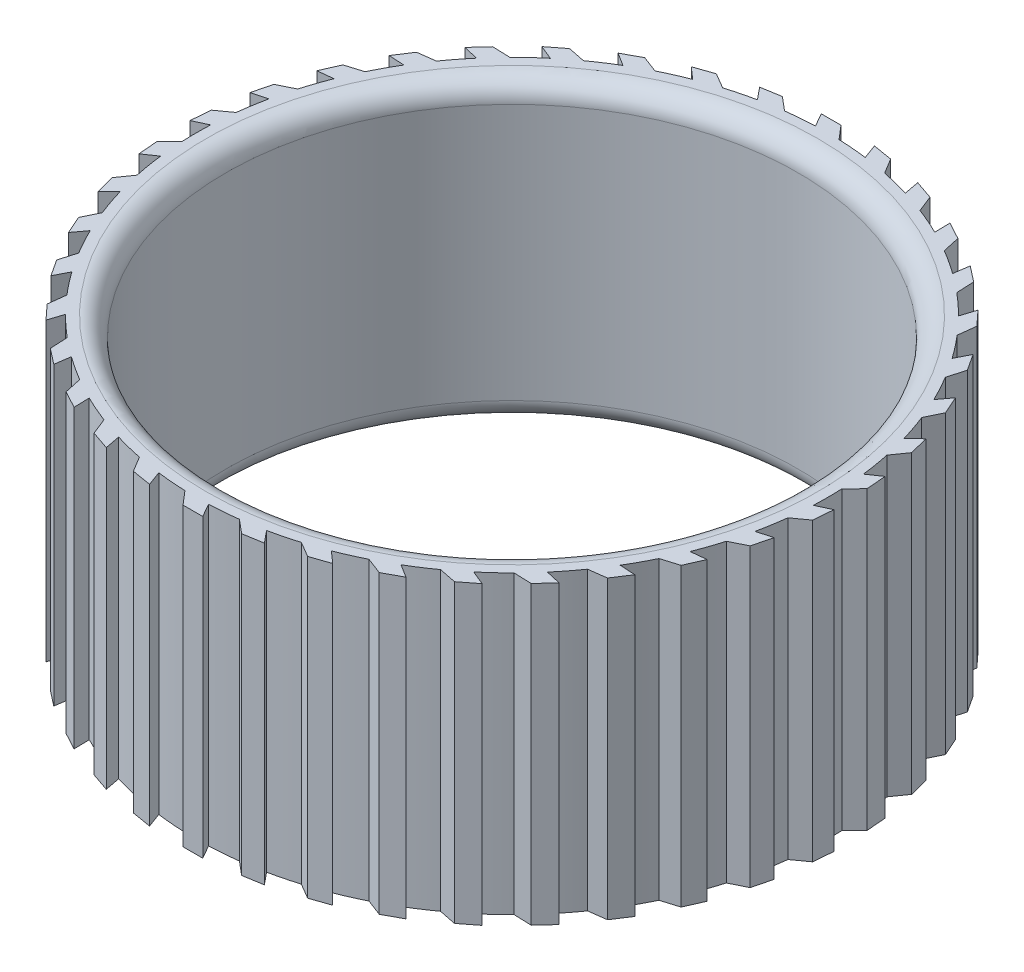
from build123d import *

# Parameters (mm, degrees)
SKETCH1_R           = 32
SKETCH1_R_2         = 29
BOSS_EXTRUDE1_DEPTH = 15
BOSS_EXTRUDE2_START = -30
BOSS_EXTRUDE2_DEPTH = 30
FILLET1_R           = 2


with BuildPart() as part:
    # Sketch1 → Boss-Extrude1 (new, symmetric)
    with BuildSketch(Plane(origin=(0, 0, 0), x_dir=(1, 0, 0), z_dir=(0, 1, 0))):
        with Locations(Location((0, 0, 0), (0, 0, 270))):
            Circle(SKETCH1_R)
        with Locations(Location((0, 0, 0), (0, 0, 270))):
            Circle(SKETCH1_R_2, mode=Mode.SUBTRACT)
    extrude(amount=BOSS_EXTRUDE1_DEPTH, both=True)

    # Sketch2 → Boss-Extrude2 (add)
    with BuildSketch(Plane.XZ.offset(15).offset(BOSS_EXTRUDE2_START)):
        with BuildLine():
            Line((0, 33.345654869), (2, 33.345654869))
            Line((2, 33.345654869), (1.217357341, 31.976836008))
            ThreePointArc((1.217357341, 31.976836008), (0.022430691, 31.999992139), (-1.172527247, 31.97851122))
            Line((-1.172527247, 31.97851122), (0, 33.345654869))
        make_face()
        with BuildLine():
            Line((5.488514401, 32.890863599), (4.106954448, 31.73535765))
            ThreePointArc((4.106954448, 31.73535765), (5.289150361, 31.559861984), (6.463968395, 31.340343211))
            Line((6.463968395, 31.340343211), (7.461237008, 32.561674419))
            Line((7.461237008, 32.561674419), (5.488514401, 32.890863599))
        make_face()
        with BuildLine():
            Line((10.827316436, 31.538895311), (9.274409132, 30.626546251))
            ThreePointArc((9.274409132, 30.626546251), (10.411595797, 30.258861065), (11.534259241, 29.848967549))
            Line((11.534259241, 29.848967549), (12.71895092, 30.889496372))
            Line((12.71895092, 30.889496372), (10.827316436, 31.538895311))
        make_face()
        with BuildLine():
            Line((15.870777504, 29.326628174), (14.188882112, 28.682322507))
            ThreePointArc((14.188882112, 28.682322507), (15.25004004, 28.132477296), (16.289925563, 27.543389863))
            Line((16.289925563, 27.543389863), (17.629725006, 28.374733388))
            Line((17.629725006, 28.374733388), (15.870777504, 29.326628174))
        make_face()
        with BuildLine():
            Line((20.481325133, 26.314407069), (18.716319375, 25.955719775))
            ThreePointArc((18.716319375, 25.955719775), (19.672502945, 25.238712881), (20.60124518, 24.486500302))
            Line((20.60124518, 24.486500302), (22.059606152, 25.085981644))
            Line((22.059606152, 25.085981644), (20.481325133, 26.314407069))
        make_face()
        with BuildLine():
            Line((24.533195604, 22.584397536), (22.733224236, 22.521112669))
            ThreePointArc((22.733224236, 22.521112669), (23.558351252, 21.656502172), (24.350616532, 20.761682844))
            Line((24.350616532, 20.761682844), (25.887758747, 21.112949715))
            Line((25.887758747, 21.112949715), (24.533195604, 22.584397536))
        make_face()
        with BuildLine():
            Line((27.915864452, 18.238344512), (26.130026, 18.472188317))
            ThreePointArc((26.130026, 18.472188317), (26.801589148, 17.483558537), (27.435766543, 16.470540799))
            Line((27.435766543, 16.470540799), (29.009760768, 16.564011555))
            Line((29.009760768, 16.564011555), (27.915864452, 18.238344512))
        make_face()
        with BuildLine():
            Line((30.537061289, 13.394796993), (28.814068771, 13.919390822))
            ThreePointArc((28.814068771, 13.919390822), (29.31374956, 12.833709002), (29.772540361, 11.730125337))
            Line((29.772540361, 11.730125337), (31.340452138, 11.56325034))
            Line((31.340452138, 11.56325034), (30.537061289, 13.394796993))
        make_face()
        with BuildLine():
            Line((32.325286698, 8.185874329), (30.712138859, 8.98690863))
            ThreePointArc((30.712138859, 8.98690863), (31.026307298, 7.83378934), (31.29719689, 6.669742634))
            Line((31.29719689, 6.669742634), (32.816257672, 6.247073798))
            Line((32.816257672, 6.247073798), (32.325286698, 8.185874329))
        make_face()
        with BuildLine():
            Line((33.231762551, 2.753662353), (31.772461859, 3.809286998))
            ThreePointArc((31.772461859, 3.809286998), (31.892548253, 2.620184327), (31.968147474, 1.427426739))
            Line((31.968147474, 1.427426739), (33.396921242, 0.760493367))
            Line((33.396921242, 0.760493367), (33.231762551, 2.753662353))
        make_face()
        with BuildLine():
            Line((33.231762551, -2.753662353), (31.966114924, -1.472242054))
            ThreePointArc((31.966114924, -1.472242054), (31.88884363, -2.664892485), (31.767090329, -3.853825637))
            Line((31.767090329, -3.853825637), (33.06660386, -4.746831339))
            Line((33.06660386, -4.746831339), (33.231762551, -2.753662353))
        make_face()
        with BuildLine():
            Line((32.325286698, -8.185874329), (31.287815704, -6.71361218))
            ThreePointArc((31.287815704, -6.71361218), (31.01529448, -7.877277977), (30.69950977, -9.029955695))
            Line((30.69950977, -9.029955695), (31.834315723, -10.124674861))
            Line((31.834315723, -10.124674861), (32.325286698, -8.185874329))
        make_face()
        with BuildLine():
            Line((30.537061289, -13.394796993), (29.756066432, -11.771852467))
            ThreePointArc((29.756066432, -11.771852467), (29.295728948, -12.87479186), (28.794526613, -13.959772101))
            Line((28.794526613, -13.959772101), (29.733670439, -15.226343646))
            Line((29.733670439, -15.226343646), (30.537061289, -13.394796993))
        make_face()
        with BuildLine():
            Line((27.915864452, -18.238344512), (27.412649236, -16.508987305))
            ThreePointArc((27.412649236, -16.508987305), (26.777052298, -17.521114983), (26.104103832, -18.508802315))
            Line((26.104103832, -18.508802315), (26.821968136, -19.912677468))
            Line((26.821968136, -19.912677468), (27.915864452, -18.238344512))
        make_face()
        with BuildLine():
            Line((24.533195604, -22.584397536), (24.321486429, -20.795800006))
            ThreePointArc((24.321486429, -20.795800006), (23.527967464, -21.689507764), (22.701629146, -22.552960651))
            Line((22.701629146, -22.552960651), (23.178632461, -24.055845358))
            Line((23.178632461, -24.055845358), (24.533195604, -22.584397536))
        make_face()
        with BuildLine():
            Line((20.481325133, -26.314407069), (20.566896873, -24.515357493))
            ThreePointArc((20.566896873, -24.515357493), (19.63710101, -25.266267313), (18.679913196, -25.981933011))
            Line((18.679913196, -25.981933011), (18.903044115, -27.542832495))
            Line((18.903044115, -27.542832495), (20.481325133, -26.314407069))
        make_face()
        with BuildLine():
            Line((15.870777504, -29.326628174), (16.251295985, -27.566199934))
            ThreePointArc((16.251295985, -27.566199934), (15.210585631, -28.153828954), (14.148657908, -28.702185969))
            Line((14.148657908, -28.702185969), (14.111830001, -30.27852296))
            Line((14.111830001, -30.27852296), (15.870777504, -29.326628174))
        make_face()
        with BuildLine():
            Line((10.827316436, -31.538895311), (11.492402106, -29.865108301))
            ThreePointArc((11.492402106, -29.865108301), (10.369165127, -30.273427532), (9.231464116, -30.639518114))
            Line((9.231464116, -30.639518114), (8.935681953, -32.188294249))
            Line((8.935681953, -32.188294249), (10.827316436, -31.538895311))
        make_face()
        with BuildLine():
            Line((5.488514401, -32.890863599), (6.420025456, -31.349374366))
            ThreePointArc((6.420025456, -31.349374366), (5.244900829, -31.567245925), (4.062460048, -31.741084077))
            Line((4.062460048, -31.741084077), (3.515791794, -33.22005278))
            Line((3.515791794, -33.22005278), (5.488514401, -32.890863599))
        make_face()
        with BuildLine():
            Line((0, -33.345654869), (1.172527247, -31.97851122))
            ThreePointArc((1.172527247, -31.97851122), (-0.022430691, -31.999992139), (-1.217357341, -31.976836008))
            Line((-1.217357341, -31.976836008), (-2, -33.345654869))
            Line((-2, -33.345654869), (0, -33.345654869))
        make_face()
        with BuildLine():
            Line((-5.488514401, -32.890863599), (-4.106954448, -31.73535765))
            ThreePointArc((-4.106954448, -31.73535765), (-5.289150361, -31.559861984), (-6.463968395, -31.340343211))
            Line((-6.463968395, -31.340343211), (-7.461237008, -32.561674419))
            Line((-7.461237008, -32.561674419), (-5.488514401, -32.890863599))
        make_face()
        with BuildLine():
            Line((-10.827316436, -31.538895311), (-9.274409132, -30.626546251))
            ThreePointArc((-9.274409132, -30.626546251), (-10.411595797, -30.258861065), (-11.534259241, -29.848967549))
            Line((-11.534259241, -29.848967549), (-12.71895092, -30.889496372))
            Line((-12.71895092, -30.889496372), (-10.827316436, -31.538895311))
        make_face()
        with BuildLine():
            Line((-15.870777504, -29.326628174), (-14.188882112, -28.682322507))
            ThreePointArc((-14.188882112, -28.682322507), (-15.25004004, -28.132477296), (-16.289925563, -27.543389863))
            Line((-16.289925563, -27.543389863), (-17.629725006, -28.374733388))
            Line((-17.629725006, -28.374733388), (-15.870777504, -29.326628174))
        make_face()
        with BuildLine():
            Line((-20.481325133, -26.314407069), (-18.716319375, -25.955719775))
            ThreePointArc((-18.716319375, -25.955719775), (-19.672502945, -25.238712881), (-20.60124518, -24.486500302))
            Line((-20.60124518, -24.486500302), (-22.059606152, -25.085981644))
            Line((-22.059606152, -25.085981644), (-20.481325133, -26.314407069))
        make_face()
        with BuildLine():
            Line((-24.533195604, -22.584397536), (-22.733224236, -22.521112669))
            ThreePointArc((-22.733224236, -22.521112669), (-23.558351252, -21.656502172), (-24.350616532, -20.761682844))
            Line((-24.350616532, -20.761682844), (-25.887758747, -21.112949715))
            Line((-25.887758747, -21.112949715), (-24.533195604, -22.584397536))
        make_face()
        with BuildLine():
            Line((-27.915864452, -18.238344512), (-26.130026, -18.472188317))
            ThreePointArc((-26.130026, -18.472188317), (-26.801589148, -17.483558537), (-27.435766543, -16.470540799))
            Line((-27.435766543, -16.470540799), (-29.009760768, -16.564011555))
            Line((-29.009760768, -16.564011555), (-27.915864452, -18.238344512))
        make_face()
        with BuildLine():
            Line((-30.537061289, -13.394796993), (-28.814068771, -13.919390822))
            ThreePointArc((-28.814068771, -13.919390822), (-29.31374956, -12.833709002), (-29.772540361, -11.730125337))
            Line((-29.772540361, -11.730125337), (-31.340452138, -11.56325034))
            Line((-31.340452138, -11.56325034), (-30.537061289, -13.394796993))
        make_face()
        with BuildLine():
            Line((-32.325286698, -8.185874329), (-30.712138859, -8.98690863))
            ThreePointArc((-30.712138859, -8.98690863), (-31.026307298, -7.83378934), (-31.29719689, -6.669742634))
            Line((-31.29719689, -6.669742634), (-32.816257672, -6.247073798))
            Line((-32.816257672, -6.247073798), (-32.325286698, -8.185874329))
        make_face()
        with BuildLine():
            Line((-33.231762551, -2.753662353), (-31.772461859, -3.809286998))
            ThreePointArc((-31.772461859, -3.809286998), (-31.892548253, -2.620184327), (-31.968147474, -1.427426739))
            Line((-31.968147474, -1.427426739), (-33.396921242, -0.760493367))
            Line((-33.396921242, -0.760493367), (-33.231762551, -2.753662353))
        make_face()
        with BuildLine():
            Line((-33.231762551, 2.753662353), (-31.966114924, 1.472242054))
            ThreePointArc((-31.966114924, 1.472242054), (-31.88884363, 2.664892485), (-31.767090329, 3.853825637))
            Line((-31.767090329, 3.853825637), (-33.06660386, 4.746831339))
            Line((-33.06660386, 4.746831339), (-33.231762551, 2.753662353))
        make_face()
        with BuildLine():
            Line((-32.325286698, 8.185874329), (-31.287815704, 6.71361218))
            ThreePointArc((-31.287815704, 6.71361218), (-31.01529448, 7.877277977), (-30.69950977, 9.029955695))
            Line((-30.69950977, 9.029955695), (-31.834315723, 10.124674861))
            Line((-31.834315723, 10.124674861), (-32.325286698, 8.185874329))
        make_face()
        with BuildLine():
            Line((-30.537061289, 13.394796993), (-29.756066432, 11.771852467))
            ThreePointArc((-29.756066432, 11.771852467), (-29.295728948, 12.87479186), (-28.794526613, 13.959772101))
            Line((-28.794526613, 13.959772101), (-29.733670439, 15.226343646))
            Line((-29.733670439, 15.226343646), (-30.537061289, 13.394796993))
        make_face()
        with BuildLine():
            Line((-27.915864452, 18.238344512), (-27.412649236, 16.508987305))
            ThreePointArc((-27.412649236, 16.508987305), (-26.777052298, 17.521114983), (-26.104103832, 18.508802315))
            Line((-26.104103832, 18.508802315), (-26.821968136, 19.912677468))
            Line((-26.821968136, 19.912677468), (-27.915864452, 18.238344512))
        make_face()
        with BuildLine():
            Line((-24.533195604, 22.584397536), (-24.321486429, 20.795800006))
            ThreePointArc((-24.321486429, 20.795800006), (-23.527967464, 21.689507764), (-22.701629146, 22.552960651))
            Line((-22.701629146, 22.552960651), (-23.178632461, 24.055845358))
            Line((-23.178632461, 24.055845358), (-24.533195604, 22.584397536))
        make_face()
        with BuildLine():
            Line((-20.481325133, 26.314407069), (-20.566896873, 24.515357493))
            ThreePointArc((-20.566896873, 24.515357493), (-19.63710101, 25.266267313), (-18.679913196, 25.981933011))
            Line((-18.679913196, 25.981933011), (-18.903044115, 27.542832495))
            Line((-18.903044115, 27.542832495), (-20.481325133, 26.314407069))
        make_face()
        with BuildLine():
            Line((-15.870777504, 29.326628174), (-16.251295985, 27.566199934))
            ThreePointArc((-16.251295985, 27.566199934), (-15.210585631, 28.153828954), (-14.148657908, 28.702185969))
            Line((-14.148657908, 28.702185969), (-14.111830001, 30.27852296))
            Line((-14.111830001, 30.27852296), (-15.870777504, 29.326628174))
        make_face()
        with BuildLine():
            Line((-10.827316436, 31.538895311), (-11.492402106, 29.865108301))
            ThreePointArc((-11.492402106, 29.865108301), (-10.369165127, 30.273427532), (-9.231464116, 30.639518114))
            Line((-9.231464116, 30.639518114), (-8.935681953, 32.188294249))
            Line((-8.935681953, 32.188294249), (-10.827316436, 31.538895311))
        make_face()
        with BuildLine():
            Line((-5.488514401, 32.890863599), (-6.420025456, 31.349374366))
            ThreePointArc((-6.420025456, 31.349374366), (-5.244900829, 31.567245925), (-4.062460048, 31.741084077))
            Line((-4.062460048, 31.741084077), (-3.515791794, 33.22005278))
            Line((-3.515791794, 33.22005278), (-5.488514401, 32.890863599))
        make_face()
    extrude(amount=BOSS_EXTRUDE2_DEPTH)

    # Fillet1
    fillet1_edges = [part.edges().sort_by_distance(p)[0] for p in [
        (0, -15, -29),
        (0, 15, -29),
    ]]
    fillet(fillet1_edges, radius=FILLET1_R)


solid = part.part
